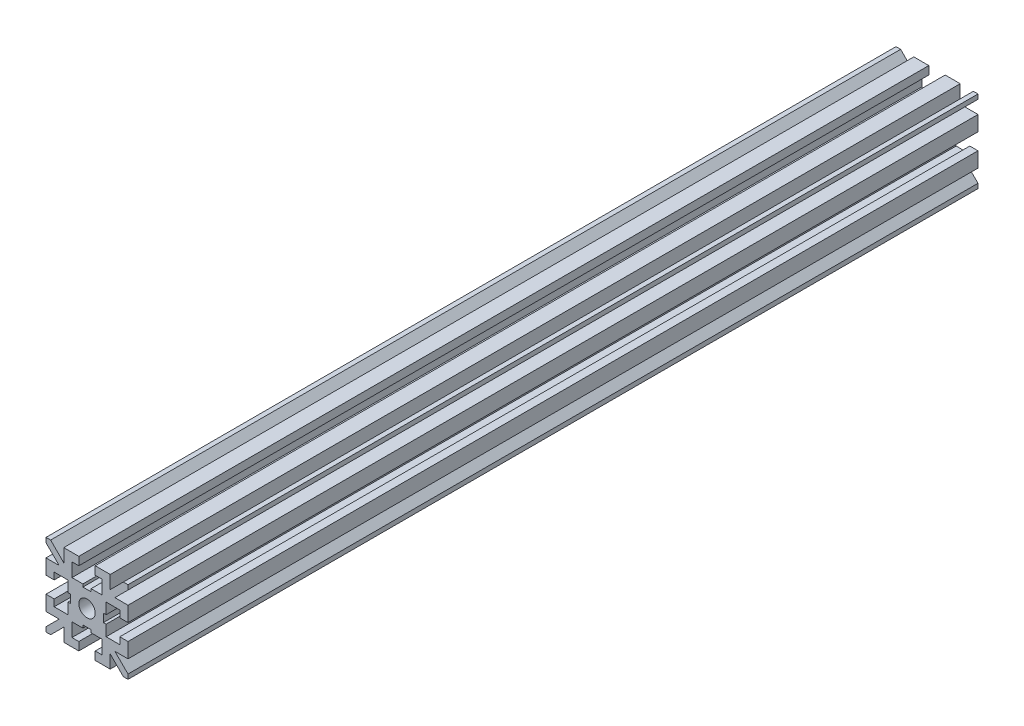
from build123d import *

# Parameters (mm, degrees)
SKETCH1_W           = 15
SKETCH1_H           = 15
BOSS_EXTRUDE1_DEPTH = 155.5
SKETCH2_R           = 1.5
CUT_EXTRUDE1_DEPTH  = 330
SKETCH3_W           = 3
SKETCH3_H           = 1.5
SKETCH3_W_2         = 1.5
SKETCH3_H_2         = 3
CUT_EXTRUDE2_DEPTH  = 330


with BuildPart() as part:
    # Sketch1 → Boss-Extrude1 (new body)
    with BuildSketch(Plane.XY):
        with Locations((-1.500578266, -3.738353388)):
            Rectangle(SKETCH1_W, SKETCH1_H)
    extrude(amount=BOSS_EXTRUDE1_DEPTH)

    # Sketch2 → Cut-Extrude1 (cut)
    with BuildSketch(Plane.XY.offset(155.5)):
        with Locations((-1.500578266, -3.738353388)):
            Circle(SKETCH2_R)
        Polygon((1.999421734, -4.488353388), (1.999421734, -6.488353388), (4.499421734, -6.488353388), (4.499421734, -0.988353388), (1.999421734, -0.988353388), (1.999421734, -2.988353388), (1.499421734, -2.988353388), (1.499421734, -4.488353388), align=None)
        Polygon((-4.250578266, -7.238353388), (-4.250578266, -9.738353388), (1.249421734, -9.738353388), (1.249421734, -7.238353388), (-0.750578266, -7.238353388), (-0.750578266, -6.738353388), (-2.250578266, -6.738353388), (-2.250578266, -7.238353388), align=None)
        Polygon((-5.000578266, -0.988353388), (-7.500578266, -0.988353388), (-7.500578266, -6.488353388), (-5.000578266, -6.488353388), (-5.000578266, -4.488353388), (-4.500578266, -4.488353388), (-4.500578266, -2.988353388), (-5.000578266, -2.988353388), align=None)
        Polygon((1.249421734, -0.238353388), (1.249421734, 2.261646612), (-4.250578266, 2.261646612), (-4.250578266, -0.238353388), (-2.250578266, -0.238353388), (-2.250578266, -0.738353388), (-0.750578266, -0.738353388), (-0.750578266, -0.238353388), align=None)
    extrude(amount=-CUT_EXTRUDE1_DEPTH, mode=Mode.SUBTRACT)

    # Sketch3 → Cut-Extrude2 (cut)
    with BuildSketch(Plane.XY.offset(155.5)):
        Polygon((5.150893596, 3.761646612), (2.749421734, 1.360174749), (2.749421734, 3.761646612), align=None)
        Polygon((5.999421734, 0.511646612), (5.999421734, 2.913118474), (3.597949871, 0.511646612), align=None)
        with Locations((-1.500578266, 3.011646612)):
            Rectangle(SKETCH3_W, SKETCH3_H)
        Polygon((2.749421734, -8.836881526), (2.749421734, -11.238353388), (5.150893596, -11.238353388), align=None)
        Polygon((5.999421734, -10.389825251), (3.597949871, -7.988353388), (5.999421734, -7.988353388), align=None)
        with Locations((5.249421734, -3.738353388)):
            Rectangle(SKETCH3_W_2, SKETCH3_H_2)
        Polygon((-6.599106404, -7.988353388), (-9.000578266, -7.988353388), (-9.000578266, -10.389825251), align=None)
        Polygon((-8.152050129, -11.238353388), (-5.750578266, -8.836881526), (-5.750578266, -11.238353388), align=None)
        with Locations((-1.500578266, -10.488353388)):
            Rectangle(SKETCH3_W, SKETCH3_H)
        Polygon((-5.750578266, 1.360174749), (-5.750578266, 3.761646612), (-8.152050129, 3.761646612), align=None)
        Polygon((-9.000578266, 2.913118474), (-6.599106404, 0.511646612), (-9.000578266, 0.511646612), align=None)
        with Locations((-8.250578266, -3.738353388)):
            Rectangle(SKETCH3_W_2, SKETCH3_H_2)
    extrude(amount=-CUT_EXTRUDE2_DEPTH, mode=Mode.SUBTRACT)


solid = part.part
